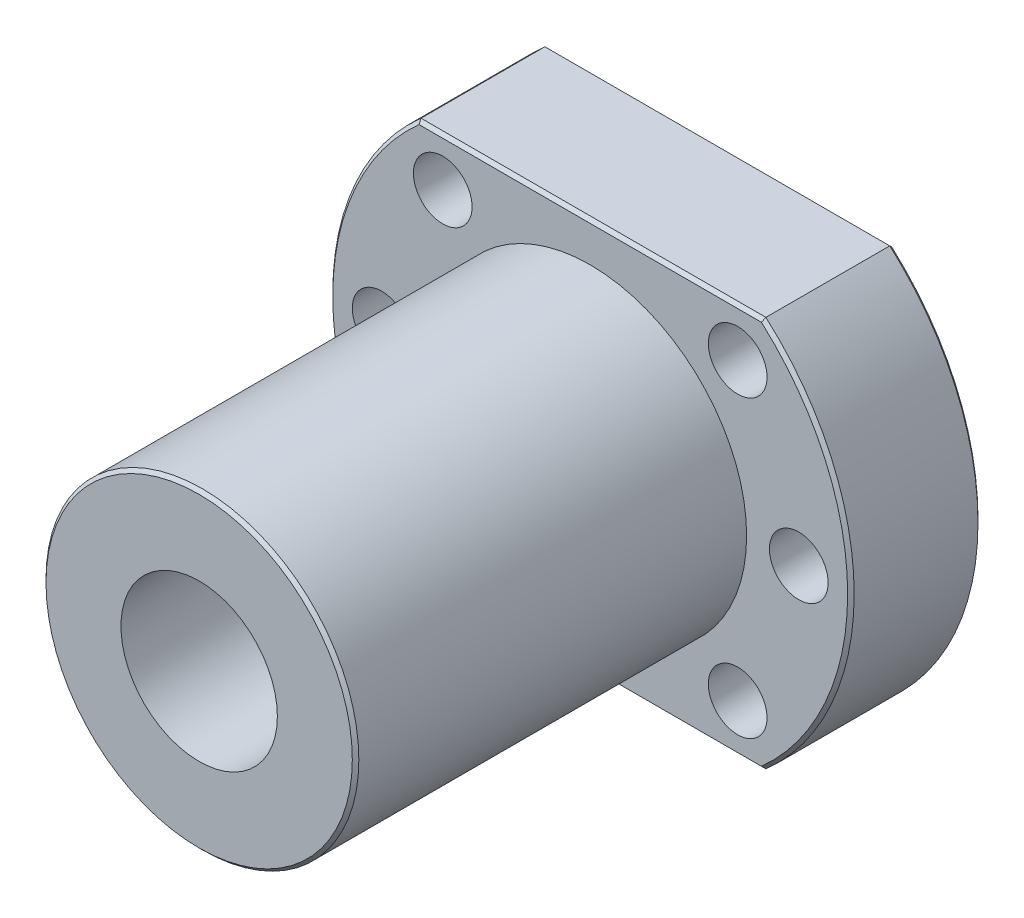
from build123d import *

# Parameters (mm, degrees)
SKETCH1_R           = 2.25
BOSS_EXTRUDE1_DEPTH = 10
SKETCH2_R           = 12
BOSS_EXTRUDE2_DEPTH = 30
SKETCH3_R           = 6
CUT_EXTRUDE1_DEPTH  = 48.16990566
CHAMFER1_SIZE       = 0.25
SKETCH4_R           = 3.5
CUT_EXTRUDE2_DEPTH  = 5


with BuildPart() as part:
    # Sketch1 → Boss-Extrude1 (new body)
    with BuildSketch(Plane.XY):
        with BuildLine():
            Line((-13.228756555, 15), (13.228756555, 15))
            ThreePointArc((13.228756555, 15), (20, 0), (13.228756555, -15))
            Line((13.228756555, -15), (-13.228756555, -15))
            ThreePointArc((-13.228756555, -15), (-20, 0), (-13.228756555, 15))
        make_face()
        with Locations((-16, 0)):
            Circle(SKETCH1_R, mode=Mode.SUBTRACT)
        with Locations((-11.313708499, 11.313708499)):
            Circle(SKETCH1_R, mode=Mode.SUBTRACT)
        with Locations((11.313708499, 11.313708499)):
            Circle(SKETCH1_R, mode=Mode.SUBTRACT)
        with Locations((16, 0)):
            Circle(SKETCH1_R, mode=Mode.SUBTRACT)
        with Locations((11.313708499, -11.313708499)):
            Circle(SKETCH1_R, mode=Mode.SUBTRACT)
        with Locations((-11.313708499, -11.313708499)):
            Circle(SKETCH1_R, mode=Mode.SUBTRACT)
    extrude(amount=BOSS_EXTRUDE1_DEPTH)

    # Sketch2 → Boss-Extrude2 (add)
    with BuildSketch(Plane.XY.offset(10)):
        Circle(SKETCH2_R)
    extrude(amount=BOSS_EXTRUDE2_DEPTH)

    # Sketch3 → Cut-Extrude1 (cut, through all)
    with BuildSketch(Plane.XY.offset(40)):
        Circle(SKETCH3_R)
    extrude(amount=-CUT_EXTRUDE1_DEPTH, mode=Mode.SUBTRACT)

    # Chamfer1
    chamfer1_edges = [part.edges().sort_by_distance(p)[0] for p in [
        (20, 0, 10),
        (0, 15, 10),
        (-12, 0, 40),
        (-20, 0, 10),
        (0, 15, 0),
        (20, 0, 0),
        (0, -15, 0),
        (-20, 0, 0),
        (0, -15, 10),
    ]]
    chamfer(chamfer1_edges, length=CHAMFER1_SIZE)

    # Sketch4 → Cut-Extrude2 (cut)
    with BuildSketch(Plane(origin=(0, 0, 0), x_dir=(-1, 0, 0), z_dir=(0, 0, -1))):
        with Locations((-11.313708499, 11.313708499)):
            Circle(SKETCH4_R)
        with Locations((11.313708499, 11.313708499)):
            Circle(SKETCH4_R)
        with Locations((16, 0)):
            Circle(SKETCH4_R)
        with Locations((11.313708499, -11.313708499)):
            Circle(SKETCH4_R)
        with Locations((-11.313708499, -11.313708499)):
            Circle(SKETCH4_R)
        with Locations((-16, 0)):
            Circle(SKETCH4_R)
    extrude(amount=-CUT_EXTRUDE2_DEPTH, mode=Mode.SUBTRACT)


solid = part.part
